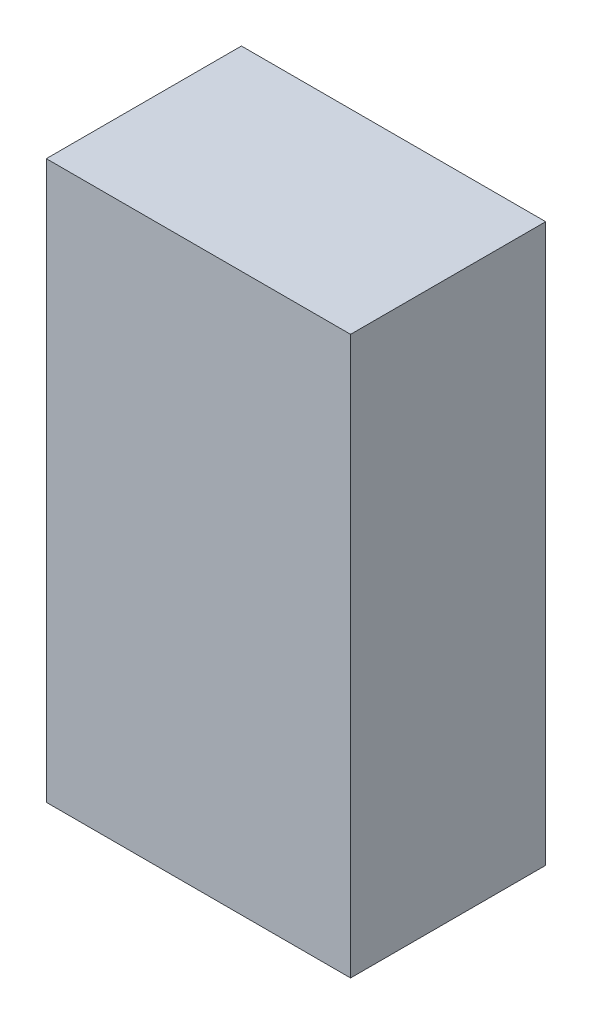
from build123d import *

# Parameters (mm, degrees)
SKETCH1_W           = 26.2
SKETCH1_H           = 16.8
BOSS_EXTRUDE1_DEPTH = 48


with BuildPart() as part:
    # Sketch1 → Boss-Extrude1 (new body)
    with BuildSketch(Plane(origin=(0, 0, 0), x_dir=(1, 0, 0), z_dir=(0, 1, 0))):
        Rectangle(SKETCH1_W, SKETCH1_H)
    extrude(amount=BOSS_EXTRUDE1_DEPTH)


solid = part.part
